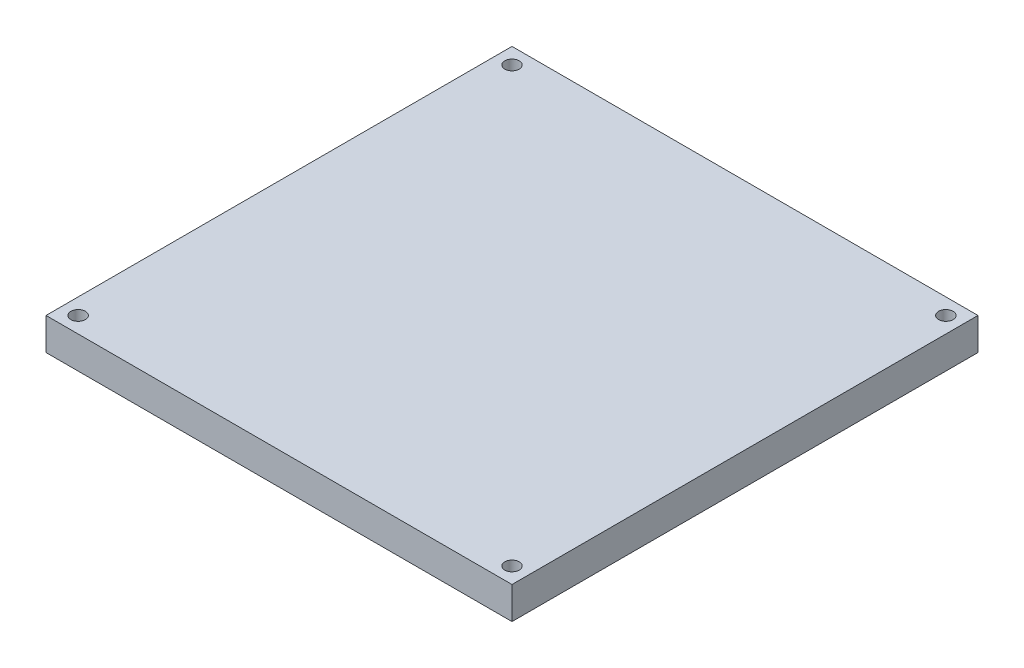
from build123d import *

# Parameters (mm, degrees)
SKETCH1_W                                    = 145
SKETCH1_H                                    = 145
BOSS_EXTRUDE1_DEPTH                          = 10
SKETCH2_R                                    = 5.5
CUT_EXTRUDE1_100_POCKETS_11_DEPTH_3MM_DEPTH  = 3
SKETCH3_R                                    = 2.25
CUT_EXTRUDE2_4_CORNER_HOLES_4_5_THRU_DEPTH   = 206.304651676
SKETCH4_R                                    = 4
CUT_EXTRUDE3_4_COUNTERBORES_8_DEPTH_4M_DEPTH = 4


with BuildPart() as part:
    # Sketch1 → Boss-Extrude1 (new body)
    with BuildSketch(Plane(origin=(0, 0, 0), x_dir=(1, 0, 0), z_dir=(0, 1, 0))):
        with Locations((72.5, 72.5)):
            Rectangle(SKETCH1_W, SKETCH1_H)
    extrude(amount=BOSS_EXTRUDE1_DEPTH)

    # Sketch2 → Cut-Extrude1 _100 Pockets _11 Depth 3mm (cut)
    with BuildSketch(Plane(origin=(0, 0, 0), x_dir=(1, 0, 0), z_dir=(0, 1, 0))):
        with Locations(Location((15, 15, 0), (0, 0, 270))):
            Circle(SKETCH2_R)
        with Locations(Location((27.778, 15, 0), (0, 0, 270))):
            Circle(SKETCH2_R)
        with Locations(Location((40.556, 15, 0), (0, 0, 270))):
            Circle(SKETCH2_R)
        with Locations(Location((53.334, 15, 0), (0, 0, 270))):
            Circle(SKETCH2_R)
        with Locations(Location((66.112, 15, 0), (0, 0, 270))):
            Circle(SKETCH2_R)
        with Locations(Location((78.89, 15, 0), (0, 0, 270))):
            Circle(SKETCH2_R)
        with Locations(Location((91.668, 15, 0), (0, 0, 270))):
            Circle(SKETCH2_R)
        with Locations(Location((104.446, 15, 0), (0, 0, 270))):
            Circle(SKETCH2_R)
        with Locations(Location((117.224, 15, 0), (0, 0, 270))):
            Circle(SKETCH2_R)
        with Locations(Location((130.002, 15, 0), (0, 0, 270))):
            Circle(SKETCH2_R)
        with Locations(Location((15, 27.778, 0), (0, 0, 270))):
            Circle(SKETCH2_R)
        with Locations(Location((27.778, 27.778, 0), (0, 0, 270))):
            Circle(SKETCH2_R)
        with Locations(Location((40.556, 27.778, 0), (0, 0, 270))):
            Circle(SKETCH2_R)
        with Locations(Location((53.334, 27.778, 0), (0, 0, 270))):
            Circle(SKETCH2_R)
        with Locations(Location((66.112, 27.778, 0), (0, 0, 270))):
            Circle(SKETCH2_R)
        with Locations(Location((78.89, 27.778, 0), (0, 0, 270))):
            Circle(SKETCH2_R)
        with Locations(Location((91.668, 27.778, 0), (0, 0, 270))):
            Circle(SKETCH2_R)
        with Locations(Location((104.446, 27.778, 0), (0, 0, 270))):
            Circle(SKETCH2_R)
        with Locations(Location((117.224, 27.778, 0), (0, 0, 270))):
            Circle(SKETCH2_R)
        with Locations(Location((130.002, 27.778, 0), (0, 0, 270))):
            Circle(SKETCH2_R)
        with Locations(Location((15, 40.556, 0), (0, 0, 270))):
            Circle(SKETCH2_R)
        with Locations(Location((27.778, 40.556, 0), (0, 0, 270))):
            Circle(SKETCH2_R)
        with Locations(Location((40.556, 40.556, 0), (0, 0, 270))):
            Circle(SKETCH2_R)
        with Locations(Location((53.334, 40.556, 0), (0, 0, 270))):
            Circle(SKETCH2_R)
        with Locations(Location((66.112, 40.556, 0), (0, 0, 270))):
            Circle(SKETCH2_R)
        with Locations(Location((78.89, 40.556, 0), (0, 0, 270))):
            Circle(SKETCH2_R)
        with Locations(Location((91.668, 40.556, 0), (0, 0, 270))):
            Circle(SKETCH2_R)
        with Locations(Location((104.446, 40.556, 0), (0, 0, 270))):
            Circle(SKETCH2_R)
        with Locations(Location((117.224, 40.556, 0), (0, 0, 270))):
            Circle(SKETCH2_R)
        with Locations(Location((130.002, 40.556, 0), (0, 0, 270))):
            Circle(SKETCH2_R)
        with Locations(Location((15, 53.334, 0), (0, 0, 270))):
            Circle(SKETCH2_R)
        with Locations(Location((27.778, 53.334, 0), (0, 0, 270))):
            Circle(SKETCH2_R)
        with Locations(Location((40.556, 53.334, 0), (0, 0, 270))):
            Circle(SKETCH2_R)
        with Locations(Location((53.334, 53.334, 0), (0, 0, 270))):
            Circle(SKETCH2_R)
        with Locations(Location((66.112, 53.334, 0), (0, 0, 270))):
            Circle(SKETCH2_R)
        with Locations(Location((78.89, 53.334, 0), (0, 0, 270))):
            Circle(SKETCH2_R)
        with Locations(Location((91.668, 53.334, 0), (0, 0, 270))):
            Circle(SKETCH2_R)
        with Locations(Location((104.446, 53.334, 0), (0, 0, 270))):
            Circle(SKETCH2_R)
        with Locations(Location((117.224, 53.334, 0), (0, 0, 270))):
            Circle(SKETCH2_R)
        with Locations(Location((130.002, 53.334, 0), (0, 0, 270))):
            Circle(SKETCH2_R)
        with Locations(Location((15, 66.112, 0), (0, 0, 270))):
            Circle(SKETCH2_R)
        with Locations(Location((27.778, 66.112, 0), (0, 0, 270))):
            Circle(SKETCH2_R)
        with Locations(Location((40.556, 66.112, 0), (0, 0, 270))):
            Circle(SKETCH2_R)
        with Locations(Location((53.334, 66.112, 0), (0, 0, 270))):
            Circle(SKETCH2_R)
        with Locations(Location((66.112, 66.112, 0), (0, 0, 270))):
            Circle(SKETCH2_R)
        with Locations(Location((78.89, 66.112, 0), (0, 0, 270))):
            Circle(SKETCH2_R)
        with Locations(Location((91.668, 66.112, 0), (0, 0, 270))):
            Circle(SKETCH2_R)
        with Locations(Location((104.446, 66.112, 0), (0, 0, 270))):
            Circle(SKETCH2_R)
        with Locations(Location((117.224, 66.112, 0), (0, 0, 270))):
            Circle(SKETCH2_R)
        with Locations(Location((130.002, 66.112, 0), (0, 0, 270))):
            Circle(SKETCH2_R)
        with Locations(Location((15, 78.89, 0), (0, 0, 270))):
            Circle(SKETCH2_R)
        with Locations(Location((27.778, 78.89, 0), (0, 0, 270))):
            Circle(SKETCH2_R)
        with Locations(Location((40.556, 78.89, 0), (0, 0, 270))):
            Circle(SKETCH2_R)
        with Locations(Location((53.334, 78.89, 0), (0, 0, 270))):
            Circle(SKETCH2_R)
        with Locations(Location((66.112, 78.89, 0), (0, 0, 270))):
            Circle(SKETCH2_R)
        with Locations(Location((78.89, 78.89, 0), (0, 0, 270))):
            Circle(SKETCH2_R)
        with Locations(Location((91.668, 78.89, 0), (0, 0, 270))):
            Circle(SKETCH2_R)
        with Locations(Location((104.446, 78.89, 0), (0, 0, 270))):
            Circle(SKETCH2_R)
        with Locations(Location((117.224, 78.89, 0), (0, 0, 270))):
            Circle(SKETCH2_R)
        with Locations(Location((130.002, 78.89, 0), (0, 0, 270))):
            Circle(SKETCH2_R)
        with Locations(Location((15, 91.668, 0), (0, 0, 270))):
            Circle(SKETCH2_R)
        with Locations(Location((27.778, 91.668, 0), (0, 0, 270))):
            Circle(SKETCH2_R)
        with Locations(Location((40.556, 91.668, 0), (0, 0, 270))):
            Circle(SKETCH2_R)
        with Locations(Location((53.334, 91.668, 0), (0, 0, 270))):
            Circle(SKETCH2_R)
        with Locations(Location((66.112, 91.668, 0), (0, 0, 270))):
            Circle(SKETCH2_R)
        with Locations(Location((78.89, 91.668, 0), (0, 0, 270))):
            Circle(SKETCH2_R)
        with Locations(Location((91.668, 91.668, 0), (0, 0, 270))):
            Circle(SKETCH2_R)
        with Locations(Location((104.446, 91.668, 0), (0, 0, 270))):
            Circle(SKETCH2_R)
        with Locations(Location((117.224, 91.668, 0), (0, 0, 270))):
            Circle(SKETCH2_R)
        with Locations(Location((130.002, 91.668, 0), (0, 0, 270))):
            Circle(SKETCH2_R)
        with Locations(Location((15, 104.446, 0), (0, 0, 270))):
            Circle(SKETCH2_R)
        with Locations(Location((27.778, 104.446, 0), (0, 0, 270))):
            Circle(SKETCH2_R)
        with Locations(Location((40.556, 104.446, 0), (0, 0, 270))):
            Circle(SKETCH2_R)
        with Locations(Location((53.334, 104.446, 0), (0, 0, 270))):
            Circle(SKETCH2_R)
        with Locations(Location((66.112, 104.446, 0), (0, 0, 270))):
            Circle(SKETCH2_R)
        with Locations(Location((78.89, 104.446, 0), (0, 0, 270))):
            Circle(SKETCH2_R)
        with Locations(Location((91.668, 104.446, 0), (0, 0, 270))):
            Circle(SKETCH2_R)
        with Locations(Location((104.446, 104.446, 0), (0, 0, 270))):
            Circle(SKETCH2_R)
        with Locations(Location((117.224, 104.446, 0), (0, 0, 270))):
            Circle(SKETCH2_R)
        with Locations(Location((130.002, 104.446, 0), (0, 0, 270))):
            Circle(SKETCH2_R)
        with Locations(Location((15, 117.224, 0), (0, 0, 270))):
            Circle(SKETCH2_R)
        with Locations(Location((27.778, 117.224, 0), (0, 0, 270))):
            Circle(SKETCH2_R)
        with Locations(Location((40.556, 117.224, 0), (0, 0, 270))):
            Circle(SKETCH2_R)
        with Locations(Location((53.334, 117.224, 0), (0, 0, 270))):
            Circle(SKETCH2_R)
        with Locations(Location((66.112, 117.224, 0), (0, 0, 270))):
            Circle(SKETCH2_R)
        with Locations(Location((78.89, 117.224, 0), (0, 0, 270))):
            Circle(SKETCH2_R)
        with Locations(Location((91.668, 117.224, 0), (0, 0, 270))):
            Circle(SKETCH2_R)
        with Locations(Location((104.446, 117.224, 0), (0, 0, 270))):
            Circle(SKETCH2_R)
        with Locations(Location((117.224, 117.224, 0), (0, 0, 270))):
            Circle(SKETCH2_R)
        with Locations(Location((130.002, 117.224, 0), (0, 0, 270))):
            Circle(SKETCH2_R)
        with Locations(Location((15, 130.002, 0), (0, 0, 270))):
            Circle(SKETCH2_R)
        with Locations(Location((27.778, 130.002, 0), (0, 0, 270))):
            Circle(SKETCH2_R)
        with Locations(Location((40.556, 130.002, 0), (0, 0, 270))):
            Circle(SKETCH2_R)
        with Locations(Location((53.334, 130.002, 0), (0, 0, 270))):
            Circle(SKETCH2_R)
        with Locations(Location((66.112, 130.002, 0), (0, 0, 270))):
            Circle(SKETCH2_R)
        with Locations(Location((78.89, 130.002, 0), (0, 0, 270))):
            Circle(SKETCH2_R)
        with Locations(Location((91.668, 130.002, 0), (0, 0, 270))):
            Circle(SKETCH2_R)
        with Locations(Location((104.446, 130.002, 0), (0, 0, 270))):
            Circle(SKETCH2_R)
        with Locations(Location((117.224, 130.002, 0), (0, 0, 270))):
            Circle(SKETCH2_R)
        with Locations(Location((130.002, 130.002, 0), (0, 0, 270))):
            Circle(SKETCH2_R)
    extrude(amount=CUT_EXTRUDE1_100_POCKETS_11_DEPTH_3MM_DEPTH, mode=Mode.SUBTRACT)

    # Sketch3 → Cut-Extrude2 _4 Corner Holes _4.5 Thru (cut, through all)
    with BuildSketch(Plane(origin=(0, 0, 0), x_dir=(1, 0, 0), z_dir=(0, 1, 0))):
        with Locations(Location((5, 5, 0), (0, 0, 270))):
            Circle(SKETCH3_R)
        with Locations(Location((140, 5, 0), (0, 0, 270))):
            Circle(SKETCH3_R)
        with Locations(Location((5, 140, 0), (0, 0, 270))):
            Circle(SKETCH3_R)
        with Locations(Location((140, 140, 0), (0, 0, 270))):
            Circle(SKETCH3_R)
    extrude(amount=CUT_EXTRUDE2_4_CORNER_HOLES_4_5_THRU_DEPTH, mode=Mode.SUBTRACT)

    # Sketch4 → Cut-Extrude3 _4 Counterbores _8 Depth 4m (cut)
    with BuildSketch(Plane(origin=(0, 0, 0), x_dir=(1, 0, 0), z_dir=(0, 1, 0))):
        with Locations(Location((5, 5, 0), (0, 0, 270))):
            Circle(SKETCH4_R)
        with Locations(Location((140, 5, 0), (0, 0, 270))):
            Circle(SKETCH4_R)
        with Locations(Location((5, 140, 0), (0, 0, 270))):
            Circle(SKETCH4_R)
        with Locations(Location((140, 140, 0), (0, 0, 270))):
            Circle(SKETCH4_R)
    extrude(amount=CUT_EXTRUDE3_4_COUNTERBORES_8_DEPTH_4M_DEPTH, mode=Mode.SUBTRACT)


solid = part.part
